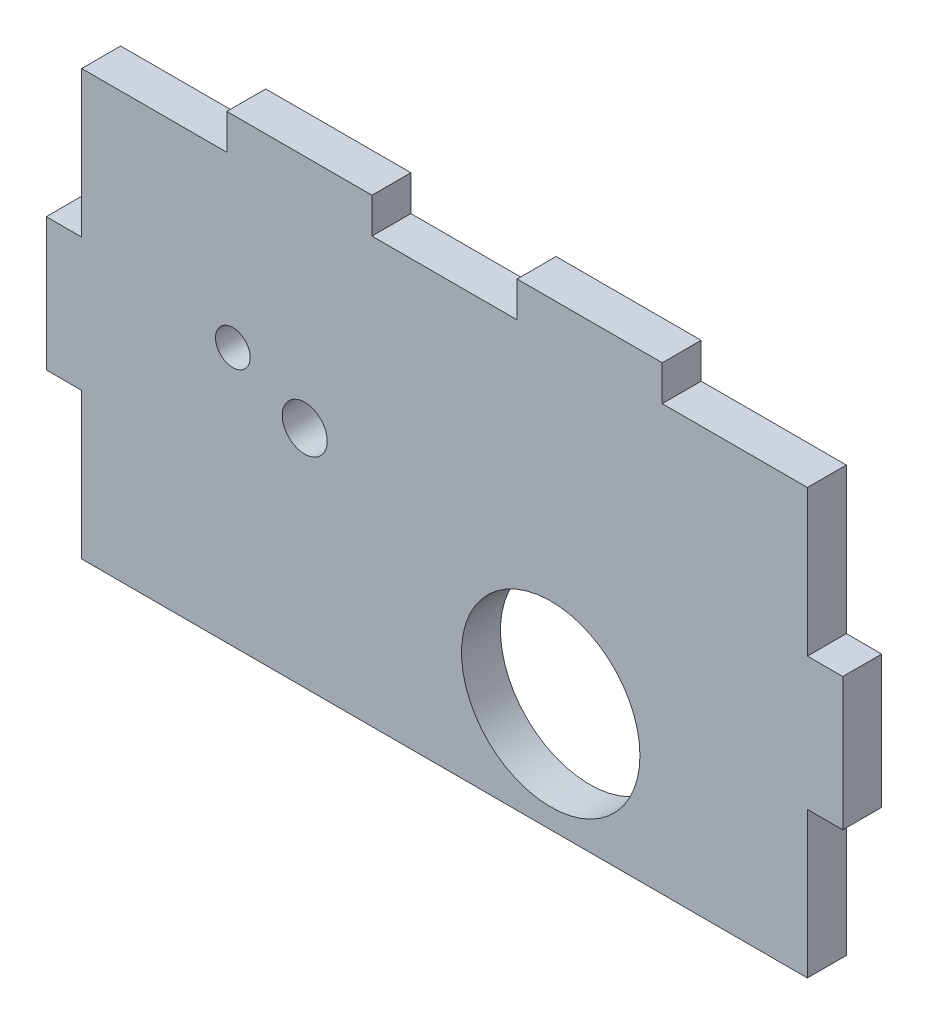
from build123d import *

# Parameters (mm, degrees)
SKETCH1_R           = 2.489200007
SKETCH1_R_2         = 3.225800007
SKETCH1_R_3         = 12.801600005
BOSS_EXTRUDE1_DEPTH = 5.588


with BuildPart() as part:
    # Sketch1 → Boss-Extrude1 (new body)
    with BuildSketch(Plane.XY):
        Polygon((5.08, -82.404335154), (5.08, -103.359335154), (109.22, -103.359335154), (109.22, -82.404335154), (114.3, -82.404335154), (114.3, -63.354335154), (109.22, -63.354335154), (109.22, -42.399335154), (88.392, -42.399335154), (88.392, -37.319335154), (67.564, -37.319335154), (67.564, -42.399335154), (46.736, -42.399335154), (46.736, -37.319335154), (25.908, -37.319335154), (25.908, -42.399335154), (5.08, -42.399335154), (5.08, -63.354335154), (0, -63.354335154), (0, -82.404335154), align=None)
        with Locations((26.772733885, -66.237193374)):
            Circle(SKETCH1_R, mode=Mode.SUBTRACT)
        with Locations((37.089955672, -71.097217628)):
            Circle(SKETCH1_R_2, mode=Mode.SUBTRACT)
        with Locations((72.39, -87.725635154)):
            Circle(SKETCH1_R_3, mode=Mode.SUBTRACT)
    extrude(amount=BOSS_EXTRUDE1_DEPTH)


solid = part.part
